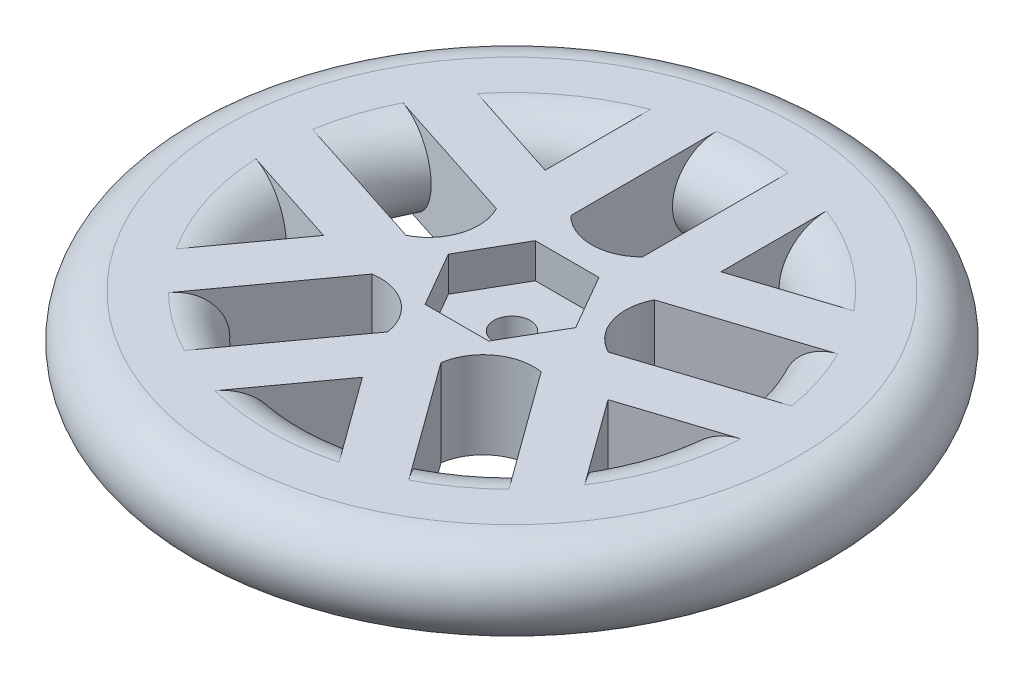
from build123d import *

# Parameters (mm, degrees)
SKETCH_1_W          = 9
SKETCH_1_H          = 10
CUT_EXTRUDE_1_DEPTH = 4
EXTRUDE_1_DEPTH     = 10
CUT_EXTRUDE_2_DEPTH = 2.5
CUT_EXTRUDE_3_DEPTH = 4
SKETCH_8_R          = 2.1
CUT_EXTRUDE_4_DEPTH = 55.07402349


with BuildPart() as part:
    # 草图1 → 旋转1 (revolve)
    with BuildSketch(Plane(origin=(0, 0, 0), x_dir=(0, 0, -1), z_dir=(1, 0, 0))):
        with Locations((4.5, -5)):
            Rectangle(SKETCH_1_W, SKETCH_1_H)
    revolve(axis=Axis((0, 0, 0), (0, 1, 0)))

    # 草图2 → 切除-拉伸1 (cut)
    with BuildSketch(Plane(origin=(0, 0, 0), x_dir=(1, 0, 0), z_dir=(0, 1, 0))):
        Polygon((7.273277686, -0.139397656), (3.757360754, 6.229144417), (-3.515916932, 6.368542072), (-7.273277686, 0.139397656), (-3.757360754, -6.229144417), (3.515916932, -6.368542072), align=None)
    extrude(amount=-CUT_EXTRUDE_1_DEPTH, mode=Mode.SUBTRACT)



with BuildPart() as body_2:
    # 草图4 → 旋转2 (revolve)
    with BuildSketch(Plane.XY, mode=Mode.PRIVATE) as revolve_2_sk:
        with BuildLine():
            Line((28, 0), (33, 0))
            ThreePointArc((33, 0), (38, -5), (33, -10))
            Line((33, -10), (28, -10))
            ThreePointArc((28, -10), (23, -5), (28, 0))
        make_face()
    revolve(revolve_2_sk.sketch.rotate(Axis((0, 0, 0), (0, 1, 0)), 90), axis=Axis((0, 0, 0), (0, 1, 0)))


with BuildPart() as part_1:
    add(part.part)

    add(body_2.part)  # 凸台-拉伸1 merges body 2
    # 草图5 → 凸台-拉伸1 (add)
    with BuildSketch(Plane(origin=(0, 0, 0), x_dir=(1, 0, 0), z_dir=(0, 1, 0))):
        with BuildLine():
            Line((4.132923872, 27.076214599), (4.132923872, 10.906852593))
            ThreePointArc((4.132923872, 10.906852593), (0, 9.183221216), (-4.132923872, 10.906852593))
            Line((-4.132923872, 10.906852593), (-4.132923872, 27.076214599))
            Line((-4.132923872, 27.076214599), (-4.132923872, 27.693301361))
            ThreePointArc((-4.132923872, 27.693301361), (-7.177152566, 27.064524401), (-10.132923872, 26.102181016))
            Line((-10.132923872, 26.102181016), (-10.132923872, 13.946773219))
            Line((-10.132923872, 13.946773219), (-5.352670057, 12.393574602))
            ThreePointArc((-5.352670057, 12.393574602), (-3.005110461, 8.217440935), (-2.508406985, 3.452526024))
            ThreePointArc((-2.508406985, 3.452526024), (0, 3.183221216), (2.508406985, 3.452526024))
            ThreePointArc((2.508406985, 3.452526024), (3.005110461, 8.217440935), (5.352670057, 12.393574602))
            Line((5.352670057, 12.393574602), (10.132923872, 13.946773219))
            Line((10.132923872, 13.946773219), (10.132923872, 26.102181016))
            ThreePointArc((10.132923872, 26.102181016), (7.177152566, 27.064524401), (4.132923872, 27.693301361))
            Line((4.132923872, 27.693301361), (4.132923872, 27.076214599))
        make_face()
        with BuildLine():
            Line((10.132923872, 8.92051691), (10.132923872, 13.946773219))
            Line((10.132923872, 13.946773219), (5.352670057, 12.393574602))
            ThreePointArc((5.352670057, 12.393574602), (3.005110461, 8.217440935), (2.508406985, 3.452526024))
            ThreePointArc((2.508406985, 3.452526024), (6.886620546, 5.397358786), (10.132923872, 8.92051691))
        make_face()
        with BuildLine():
            Line((21.693403666, 17.703000802), (10.132923872, 13.946773219))
            Line((10.132923872, 13.946773219), (10.132923872, 8.92051691))
            ThreePointArc((10.132923872, 8.92051691), (6.886620546, 5.397358786), (2.508406985, 3.452526024))
            ThreePointArc((2.508406985, 3.452526024), (3.02742328, 0.983669452), (4.05868776, -1.318747594))
            ThreePointArc((4.05868776, -1.318747594), (8.743880951, -0.318700987), (13.441055898, -1.260866564))
            Line((13.441055898, -1.260866564), (16.395415231, -5.327193336))
            Line((16.395415231, -5.327193336), (27.955895024, -1.570965754))
            ThreePointArc((27.955895024, -1.570965754), (27.988971584, -0.785792378), (28, 0))
            ThreePointArc((28, 0), (27.90359364, 2.32152148), (27.61503843, 4.627056571))
            Line((27.61503843, 4.627056571), (27.028154044, 4.436366275))
            Line((27.028154044, 4.436366275), (11.650176944, -0.560241374))
            ThreePointArc((11.650176944, -0.560241374), (8.733762378, 2.837771419), (9.095889518, 7.301046986))
            Line((9.095889518, 7.301046986), (24.473866618, 12.297654635))
            Line((24.473866618, 12.297654635), (25.060751004, 12.488344931))
            ThreePointArc((25.060751004, 12.488344931), (23.522030178, 15.189275701), (21.693403666, 17.703000802))
        make_face()
        with BuildLine():
            ThreePointArc((13.441055898, -1.260866564), (8.743880951, -0.318700987), (4.05868776, -1.318747594))
            ThreePointArc((4.05868776, -1.318747594), (7.261276026, -4.881689756), (11.615161415, -6.880391954))
            Line((11.615161415, -6.880391954), (16.395415231, -5.327193336))
            Line((16.395415231, -5.327193336), (13.441055898, -1.260866564))
        make_face()
        with BuildLine():
            Line((28.930267077, 5.054400263), (27.61503843, 4.627056571))
            ThreePointArc((27.61503843, 4.627056571), (27.90359364, 2.32152148), (28, 0))
            ThreePointArc((28, 0), (27.988971584, -0.785792378), (27.955895024, -1.570965754))
            Line((27.955895024, -1.570965754), (28.882256011, -1.269972823))
            Line((28.882256011, -1.269972823), (30.784369043, -0.651938834))
            Line((30.784369043, -0.651938834), (28.930267077, 5.054400263))
        make_face()
        with BuildLine():
            Line((22.619764652, 18.003993732), (21.693403666, 17.703000802))
            ThreePointArc((21.693403666, 17.703000802), (23.522030178, 15.189275701), (25.060751004, 12.488344931))
            Line((25.060751004, 12.488344931), (26.375979651, 12.915688623))
            Line((26.375979651, 12.915688623), (24.521877685, 18.622027721))
            Line((24.521877685, 18.622027721), (22.619764652, 18.003993732))
        make_face()
        with BuildLine():
            Line((4.132923872, 29.076214599), (4.132923872, 27.693301361))
            ThreePointArc((4.132923872, 27.693301361), (7.177152566, 27.064524401), (10.132923872, 26.102181016))
            Line((10.132923872, 26.102181016), (10.132923872, 27.076214599))
            Line((10.132923872, 27.076214599), (10.132923872, 29.076214599))
            Line((10.132923872, 29.076214599), (4.132923872, 29.076214599))
        make_face()
        with BuildLine():
            ThreePointArc((-10.132923872, 26.102181016), (-7.177152566, 27.064524401), (-4.132923872, 27.693301361))
            Line((-4.132923872, 27.693301361), (-4.132923872, 29.076214599))
            Line((-4.132923872, 29.076214599), (-10.132923872, 29.076214599))
            Line((-10.132923872, 29.076214599), (-10.132923872, 27.076214599))
            Line((-10.132923872, 27.076214599), (-10.132923872, 26.102181016))
        make_face()
        with BuildLine():
            Line((-5.352670057, 12.393574602), (-10.132923872, 13.946773219))
            Line((-10.132923872, 13.946773219), (-10.132923872, 8.92051691))
            ThreePointArc((-10.132923872, 8.92051691), (-6.886620546, 5.397358786), (-2.508406985, 3.452526024))
            ThreePointArc((-2.508406985, 3.452526024), (-3.005110461, 8.217440935), (-5.352670057, 12.393574602))
        make_face()
        with BuildLine():
            Line((-10.132923872, 8.92051691), (-10.132923872, 13.946773219))
            Line((-10.132923872, 13.946773219), (-21.693403666, 17.703000802))
            ThreePointArc((-21.693403666, 17.703000802), (-23.522030178, 15.189275701), (-25.060751004, 12.488344931))
            Line((-25.060751004, 12.488344931), (-24.473866618, 12.297654635))
            Line((-24.473866618, 12.297654635), (-9.095889518, 7.301046986))
            ThreePointArc((-9.095889518, 7.301046986), (-8.733762378, 2.837771419), (-11.650176944, -0.560241374))
            Line((-11.650176944, -0.560241374), (-27.028154044, 4.436366275))
            Line((-27.028154044, 4.436366275), (-27.61503843, 4.627056571))
            ThreePointArc((-27.61503843, 4.627056571), (-27.957754406, 1.537520268), (-27.955895024, -1.570965754))
            Line((-27.955895024, -1.570965754), (-16.395415231, -5.327193336))
            Line((-16.395415231, -5.327193336), (-13.441055898, -1.260866564))
            ThreePointArc((-13.441055898, -1.260866564), (-8.743880951, -0.318700987), (-4.05868776, -1.318747594))
            ThreePointArc((-4.05868776, -1.318747594), (-3.02742328, 0.983669452), (-2.508406985, 3.452526024))
            ThreePointArc((-2.508406985, 3.452526024), (-6.886620546, 5.397358786), (-10.132923872, 8.92051691))
        make_face()
        with BuildLine():
            ThreePointArc((-25.060751004, 12.488344931), (-23.522030178, 15.189275701), (-21.693403666, 17.703000802))
            Line((-21.693403666, 17.703000802), (-22.619764652, 18.003993732))
            Line((-22.619764652, 18.003993732), (-24.521877685, 18.622027721))
            Line((-24.521877685, 18.622027721), (-26.375979651, 12.915688623))
            Line((-26.375979651, 12.915688623), (-25.060751004, 12.488344931))
        make_face()
        with BuildLine():
            ThreePointArc((-27.955895024, -1.570965754), (-27.957754406, 1.537520268), (-27.61503843, 4.627056571))
            Line((-27.61503843, 4.627056571), (-28.930267077, 5.054400263))
            Line((-28.930267077, 5.054400263), (-30.784369043, -0.651938834))
            Line((-30.784369043, -0.651938834), (-28.882256011, -1.269972823))
            Line((-28.882256011, -1.269972823), (-27.955895024, -1.570965754))
        make_face()
        with BuildLine():
            ThreePointArc((-11.615161415, -6.880391954), (-7.261276026, -4.881689756), (-4.05868776, -1.318747594))
            ThreePointArc((-4.05868776, -1.318747594), (-8.743880951, -0.318700987), (-13.441055898, -1.260866564))
            Line((-13.441055898, -1.260866564), (-16.395415231, -5.327193336))
            Line((-16.395415231, -5.327193336), (-11.615161415, -6.880391954))
        make_face()
        with BuildLine():
            ThreePointArc((0, -4.267556859), (-1.871050485, -2.57528006), (-4.05868776, -1.318747594))
            ThreePointArc((-4.05868776, -1.318747594), (-7.261276026, -4.881689756), (-11.615161415, -6.880391954))
            Line((-11.615161415, -6.880391954), (-16.395415231, -5.327193336))
            Line((-16.395415231, -5.327193336), (-23.540184669, -15.161124818))
            ThreePointArc((-23.540184669, -15.161124818), (-21.7145667, -17.677035753), (-19.621319776, -19.97507973))
            Line((-19.621319776, -19.97507973), (-19.258605279, -19.475846053))
            Line((-19.258605279, -19.475846053), (-9.754492752, -6.394557402))
            ThreePointArc((-9.754492752, -6.394557402), (-5.397761999, -7.429382027), (-3.067281454, -11.253100804))
            Line((-3.067281454, -11.253100804), (-12.57139398, -24.334389455))
            Line((-12.57139398, -24.334389455), (-12.934108478, -24.833623132))
            ThreePointArc((-12.934108478, -24.833623132), (-10.101689906, -26.114284617), (-7.144769439, -27.073091247))
            Line((-7.144769439, -27.073091247), (0, -17.239159766))
            Line((0, -17.239159766), (-2.954359333, -13.172832994))
            ThreePointArc((-2.954359333, -13.172832994), (-2.39890516, -8.414408977), (0, -4.267556859))
        make_face()
        with BuildLine():
            ThreePointArc((-19.621319776, -19.97507973), (-21.7145667, -17.677035753), (-23.540184669, -15.161124818))
            Line((-23.540184669, -15.161124818), (-24.112707245, -15.94913454))
            Line((-24.112707245, -15.94913454), (-25.288277749, -17.567168528))
            Line((-25.288277749, -17.567168528), (-20.434175783, -21.093880042))
            Line((-20.434175783, -21.093880042), (-19.621319776, -19.97507973))
        make_face()
        with BuildLine():
            Line((-7.717292014, -27.861100969), (-7.144769439, -27.073091247))
            ThreePointArc((-7.144769439, -27.073091247), (-10.101689906, -26.114284617), (-12.934108478, -24.833623132))
            Line((-12.934108478, -24.833623132), (-13.746964485, -25.952423444))
            Line((-13.746964485, -25.952423444), (-8.892862519, -29.479134958))
            Line((-8.892862519, -29.479134958), (-7.717292014, -27.861100969))
        make_face()
        with BuildLine():
            ThreePointArc((2.954359333, -13.172832994), (2.39890516, -8.414408977), (0, -4.267556859))
            ThreePointArc((0, -4.267556859), (-2.39890516, -8.414408977), (-2.954359333, -13.172832994))
            Line((-2.954359333, -13.172832994), (0, -17.239159766))
            Line((0, -17.239159766), (2.954359333, -13.172832994))
        make_face()
        with BuildLine():
            ThreePointArc((11.615161415, -6.880391954), (7.261276026, -4.881689756), (4.05868776, -1.318747594))
            ThreePointArc((4.05868776, -1.318747594), (1.871050485, -2.57528006), (0, -4.267556859))
            ThreePointArc((0, -4.267556859), (2.39890516, -8.414408977), (2.954359333, -13.172832994))
            Line((2.954359333, -13.172832994), (0, -17.239159766))
            Line((0, -17.239159766), (7.144769439, -27.073091247))
            ThreePointArc((7.144769439, -27.073091247), (10.101689906, -26.114284617), (12.934108478, -24.833623132))
            Line((12.934108478, -24.833623132), (12.57139398, -24.334389455))
            Line((12.57139398, -24.334389455), (3.067281454, -11.253100804))
            ThreePointArc((3.067281454, -11.253100804), (5.397761999, -7.429382027), (9.754492752, -6.394557402))
            Line((9.754492752, -6.394557402), (19.258605279, -19.475846053))
            Line((19.258605279, -19.475846053), (19.621319776, -19.97507973))
            ThreePointArc((19.621319776, -19.97507973), (21.7145667, -17.677035753), (23.540184669, -15.161124818))
            Line((23.540184669, -15.161124818), (16.395415231, -5.327193336))
            Line((16.395415231, -5.327193336), (11.615161415, -6.880391954))
        make_face()
        with BuildLine():
            ThreePointArc((12.934108478, -24.833623132), (10.101689906, -26.114284617), (7.144769439, -27.073091247))
            Line((7.144769439, -27.073091247), (7.717292014, -27.861100969))
            Line((7.717292014, -27.861100969), (8.892862519, -29.479134958))
            Line((8.892862519, -29.479134958), (13.746964485, -25.952423444))
            Line((13.746964485, -25.952423444), (12.934108478, -24.833623132))
        make_face()
        with BuildLine():
            Line((24.112707245, -15.94913454), (23.540184669, -15.161124818))
            ThreePointArc((23.540184669, -15.161124818), (21.7145667, -17.677035753), (19.621319776, -19.97507973))
            Line((19.621319776, -19.97507973), (20.434175783, -21.093880042))
            Line((20.434175783, -21.093880042), (25.288277749, -17.567168528))
            Line((25.288277749, -17.567168528), (24.112707245, -15.94913454))
        make_face()
        with BuildLine():
            ThreePointArc((4.05868776, -1.318747594), (3.02742328, 0.983669452), (2.508406985, 3.452526024))
            ThreePointArc((2.508406985, 3.452526024), (0, 3.183221216), (-2.508406985, 3.452526024))
            ThreePointArc((-2.508406985, 3.452526024), (-3.02742328, 0.983669452), (-4.05868776, -1.318747594))
            ThreePointArc((-4.05868776, -1.318747594), (-1.871050485, -2.57528006), (0, -4.267556859))
            ThreePointArc((0, -4.267556859), (1.871050485, -2.57528006), (4.05868776, -1.318747594))
        make_face()
    extrude(amount=-EXTRUDE_1_DEPTH)

    # 草图6 → 切除-拉伸2 (cut)
    with BuildSketch(Plane.XZ.offset(10)):
        with BuildLine():
            Line((8.332923872, -27.068079091), (8.332923872, -11.469285762))
            Line((8.332923872, -11.469285762), (23.168257914, -16.289577993))
            ThreePointArc((23.168257914, -16.289577993), (23.859270205, -15.259546232), (24.504520414, -14.20024666))
            Line((24.504520414, -14.20024666), (7.889674226, -8.801755884))
            ThreePointArc((7.889674226, -8.801755884), (7.021860648, -2.281540829), (11.556422832, 2.483335935))
            Line((11.556422832, 2.483335935), (28.17126902, -2.915154842))
            ThreePointArc((28.17126902, -2.915154842), (28.271891301, -1.678894929), (28.318288092, -0.439414896))
            Line((28.318288092, -0.439414896), (13.482954051, 4.380877335))
            Line((13.482954051, 4.380877335), (22.651694723, 17.000566229))
            ThreePointArc((22.651694723, 17.000566229), (21.885610847, 17.976055291), (21.077550366, 18.917066276))
            Line((21.077550366, 18.917066276), (10.809010704, 4.783633936))
            ThreePointArc((10.809010704, 4.783633936), (4.339748545, 5.973151437), (1.209338226, 11.758204246))
            Line((1.209338226, 11.758204246), (11.477877888, 25.891636586))
            ThreePointArc((11.477877888, 25.891636586), (10.333218838, 26.369359385), (9.168740672, 26.79650575))
            Line((9.168740672, 26.79650575), (0, 14.176816856))
            Line((0, 14.176816856), (-9.168740672, 26.79650575))
            ThreePointArc((-9.168740672, 26.79650575), (-10.333218838, 26.369359385), (-11.477877888, 25.891636586))
            Line((-11.477877888, 25.891636586), (-1.209338226, 11.758204246))
            ThreePointArc((-1.209338226, 11.758204246), (-4.339748545, 5.973151437), (-10.809010704, 4.783633936))
            Line((-10.809010704, 4.783633936), (-21.077550366, 18.917066276))
            ThreePointArc((-21.077550366, 18.917066276), (-21.885610847, 17.976055291), (-22.651694723, 17.000566229))
            Line((-22.651694723, 17.000566229), (-13.482954051, 4.380877335))
            Line((-13.482954051, 4.380877335), (-28.318288092, -0.439414896))
            ThreePointArc((-28.318288092, -0.439414896), (-28.271891301, -1.678894929), (-28.17126902, -2.915154842))
            Line((-28.17126902, -2.915154842), (-11.556422832, 2.483335935))
            ThreePointArc((-11.556422832, 2.483335935), (-7.021860648, -2.281540829), (-7.889674226, -8.801755884))
            Line((-7.889674226, -8.801755884), (-24.504520414, -14.20024666))
            ThreePointArc((-24.504520414, -14.20024666), (-23.859270205, -15.259546232), (-23.168257914, -16.289577993))
            Line((-23.168257914, -16.289577993), (-8.332923872, -11.469285762))
            Line((-8.332923872, -11.469285762), (-8.332923872, -27.068079091))
            ThreePointArc((-8.332923872, -27.068079091), (-7.139770913, -27.406973515), (-5.932923872, -27.693301361))
            Line((-5.932923872, -27.693301361), (-5.932923872, -10.223418233))
            ThreePointArc((-5.932923872, -10.223418233), (0, -7.383221216), (5.932923872, -10.223418233))
            Line((5.932923872, -10.223418233), (5.932923872, -27.693301361))
            ThreePointArc((5.932923872, -27.693301361), (7.139770913, -27.406973515), (8.332923872, -27.068079091))
        make_face()
    extrude(amount=-CUT_EXTRUDE_2_DEPTH, mode=Mode.SUBTRACT)

    # 草图7 → 切除-拉伸3 (cut)
    with BuildSketch(Plane(origin=(0, 0, 0), x_dir=(1, 0, 0), z_dir=(0, 1, 0))):
        Polygon((7.332348419, 0), (3.666174209, 6.35), (-3.666174209, 6.35), (-7.332348419, 0), (-3.666174209, -6.35), (3.666174209, -6.35), align=None)
    extrude(amount=-CUT_EXTRUDE_3_DEPTH, mode=Mode.SUBTRACT)

    # 草图8 → 切除-拉伸4 (cut, through all)
    with BuildSketch(Plane(origin=(0, -4, 0), x_dir=(1, 0, 0), z_dir=(0, 1, 0))):
        with Locations(Location((0, 0, 0), (0, 0, 270))):
            Circle(SKETCH_8_R)
    extrude(amount=-CUT_EXTRUDE_4_DEPTH, mode=Mode.SUBTRACT)


solid = part_1.part
